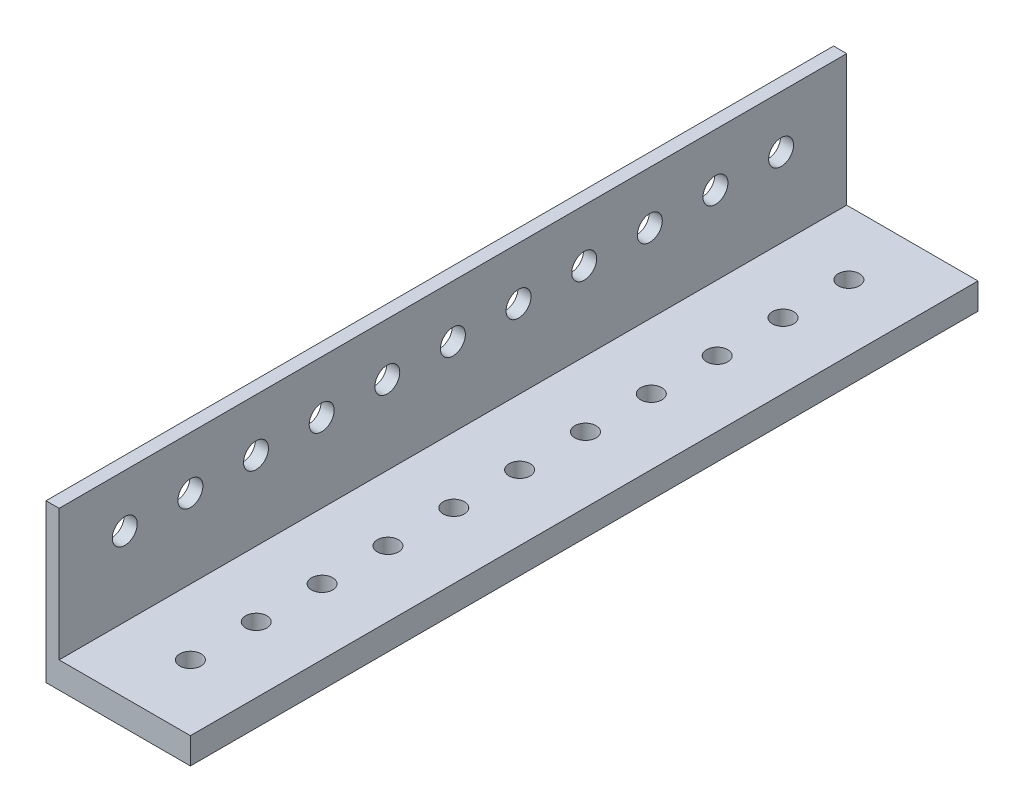
from build123d import *

# Parameters (mm, degrees)
SKETCH1_W           = 152.4
SKETCH1_H           = 30.48
SKETCH1_R           = 2.413
BOSS_EXTRUDE1_DEPTH = 2.54
SKETCH2_W           = 152.4
SKETCH2_H           = 5.08
BOSS_EXTRUDE2_DEPTH = 25.4
SKETCH3_R           = 2.054469346
CUT_EXTRUDE1_DEPTH  = 147.156860999


with BuildPart() as part:
    # Sketch1 → Boss-Extrude1 (new body)
    with BuildSketch(Plane(origin=(0, 0, 0), x_dir=(0, 0, -1), z_dir=(1, 0, 0))):
        with Locations((64.994987224, -0.229680851)):
            Rectangle(SKETCH1_W, SKETCH1_H)
        with Locations((1.494987224, 4.850319149)):
            Circle(SKETCH1_R, mode=Mode.SUBTRACT)
        with Locations((14.194987224, 4.850319149)):
            Circle(SKETCH1_R, mode=Mode.SUBTRACT)
        with Locations((26.894987224, 4.850319149)):
            Circle(SKETCH1_R, mode=Mode.SUBTRACT)
        with Locations((39.594987224, 4.850319149)):
            Circle(SKETCH1_R, mode=Mode.SUBTRACT)
        with Locations((52.294987224, 4.850319149)):
            Circle(SKETCH1_R, mode=Mode.SUBTRACT)
        with Locations((64.994987224, 4.850319149)):
            Circle(SKETCH1_R, mode=Mode.SUBTRACT)
        with Locations((77.694987224, 4.850319149)):
            Circle(SKETCH1_R, mode=Mode.SUBTRACT)
        with Locations((90.394987224, 4.850319149)):
            Circle(SKETCH1_R, mode=Mode.SUBTRACT)
        with Locations((103.094987224, 4.850319149)):
            Circle(SKETCH1_R, mode=Mode.SUBTRACT)
        with Locations((115.794987224, 4.850319149)):
            Circle(SKETCH1_R, mode=Mode.SUBTRACT)
        with Locations((128.494987224, 4.850319149)):
            Circle(SKETCH1_R, mode=Mode.SUBTRACT)
    extrude(amount=BOSS_EXTRUDE1_DEPTH)

    # Sketch2 → Boss-Extrude2 (add)
    with BuildSketch(Plane(origin=(2.54, 0, 0), x_dir=(0, 0, -1), z_dir=(1, 0, 0))):
        with Locations((64.994987224, -12.929680851)):
            Rectangle(SKETCH2_W, SKETCH2_H)
    extrude(amount=BOSS_EXTRUDE2_DEPTH)

    # Sketch3 → Cut-Extrude1 (cut, through all)
    with BuildSketch(Plane(origin=(0, -10.389680851, 0), x_dir=(1, 0, 0), z_dir=(0, 1, 0))):
        with Locations(Location((15.24, 1.494987224, 0), (0, 0, 270))):
            Circle(SKETCH3_R)
        with Locations(Location((15.24, 14.236129272, 0), (0, 0, 270))):
            Circle(SKETCH3_R)
        with Locations(Location((15.24, 26.977271321, 0), (0, 0, 270))):
            Circle(SKETCH3_R)
        with Locations(Location((15.24, 39.71841337, 0), (0, 0, 270))):
            Circle(SKETCH3_R)
        with Locations(Location((15.24, 52.459555419, 0), (0, 0, 270))):
            Circle(SKETCH3_R)
        with Locations(Location((15.24, 65.200697467, 0), (0, 0, 270))):
            Circle(SKETCH3_R)
        with Locations(Location((15.24, 77.941839516, 0), (0, 0, 270))):
            Circle(SKETCH3_R)
        with Locations(Location((15.24, 90.682981565, 0), (0, 0, 270))):
            Circle(SKETCH3_R)
        with Locations(Location((15.24, 103.424123614, 0), (0, 0, 270))):
            Circle(SKETCH3_R)
        with Locations(Location((15.24, 116.165265662, 0), (0, 0, 270))):
            Circle(SKETCH3_R)
        with Locations(Location((15.24, 128.906407711, 0), (0, 0, 270))):
            Circle(SKETCH3_R)
    extrude(amount=-CUT_EXTRUDE1_DEPTH, mode=Mode.SUBTRACT)


solid = part.part
